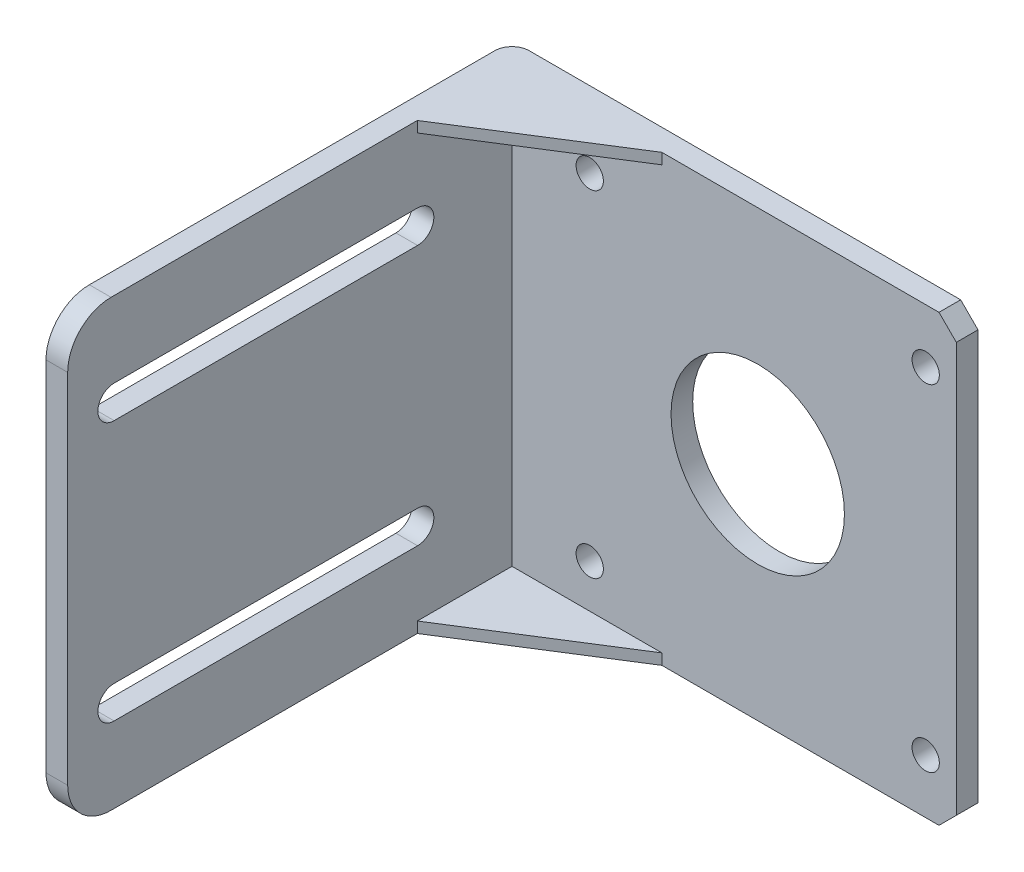
from build123d import *

# Parameters (mm, degrees)
BOSS_EXTRUDE1_DEPTH = 65.0875
SKETCH2_R           = 2
SKETCH2_R_2         = 12.7
CUT_EXTRUDE1_DEPTH  = 3.175
CUT_EXTRUDE2_DEPTH  = 3.175
BOSS_EXTRUDE2_START = -1.5875
BOSS_EXTRUDE2_DEPTH = 1.5875
CUT_EXTRUDE3_DEPTH  = 3.175


with BuildPart() as part:
    # Sketch1 → Boss-Extrude1 (new body)
    with BuildSketch(Plane(origin=(0, 0, 0), x_dir=(1, 0, 0), z_dir=(0, 1, 0))):
        with BuildLine():
            Line((32.013617701, 34.255816606), (32.013617701, 31.080816606))
            Line((32.013617701, 31.080816606), (-33.073882299, 31.080816606))
            Line((-33.073882299, 31.080816606), (-33.073882299, -34.006683394))
            Line((-33.073882299, -34.006683394), (-36.248882299, -34.006683394))
            Line((-36.248882299, -34.006683394), (-36.248882299, 31.715816606))
            ThreePointArc((-36.248882299, 31.715816606), (-35.504933523, 33.51186783), (-33.708882299, 34.255816606))
            Line((-33.708882299, 34.255816606), (32.013617701, 34.255816606))
        make_face()
    extrude(amount=BOSS_EXTRUDE1_DEPTH)

    # Sketch2 → Cut-Extrude1 (cut)
    with BuildSketch(Plane(origin=(0, 0, -34.255816606), x_dir=(-1, 0, 0), z_dir=(0, 0, -1))):
        with Locations((-27.52729049, 57.15)):
            Circle(SKETCH2_R)
        with Locations((21.68520951, 57.15)):
            Circle(SKETCH2_R)
        with Locations((21.68520951, 7.9375)):
            Circle(SKETCH2_R)
        with Locations((-27.52729049, 7.9375)):
            Circle(SKETCH2_R)
        with Locations((-2.92104049, 32.54375)):
            Circle(SKETCH2_R_2)
        Polygon((-29.473617701, 65.0875), (-32.013617701, 62.5475), (-32.013617701, 65.0875), align=None)
        Polygon((-29.473617701, 0), (-32.013617701, 2.54), (-32.013617701, 0), align=None)
    extrude(amount=-CUT_EXTRUDE1_DEPTH, mode=Mode.SUBTRACT)

    # Sketch3 → Cut-Extrude2 (cut)
    with BuildSketch(Plane.ZY.offset(36.248882299)):
        with BuildLine():
            Line((27.656683394, 65.0875), (34.006683394, 65.0875))
            Line((34.006683394, 65.0875), (34.006683394, 58.7375))
            ThreePointArc((34.006683394, 58.7375), (32.146811455, 63.227628061), (27.656683394, 65.0875))
        make_face()
        with BuildLine():
            Line((34.006683394, 6.35), (34.006683394, 0))
            Line((34.006683394, 0), (27.656683394, 0))
            ThreePointArc((27.656683394, 0), (32.146811455, 1.859871939), (34.006683394, 6.35))
        make_face()
    extrude(amount=-CUT_EXTRUDE2_DEPTH, mode=Mode.SUBTRACT)

    # Sketch4 → Boss-Extrude2 (add)
    with BuildSketch(Plane(origin=(0, 65.0875, 0), x_dir=(1, 0, 0), z_dir=(0, 1, 0)).offset(BOSS_EXTRUDE2_START)):
        with BuildLine():
            Line((-36.248882299, 31.715816606), (-36.248882299, 15.205816606))
            Line((-36.248882299, 15.205816606), (-6.086382299, 34.255816606))
            Line((-6.086382299, 34.255816606), (-33.708882299, 34.255816606))
            ThreePointArc((-33.708882299, 34.255816606), (-35.504933523, 33.51186783), (-36.248882299, 31.715816606))
        make_face()
    boss_extrude2 = extrude(amount=BOSS_EXTRUDE2_DEPTH)

    # Mirror1: Boss-Extrude2 across plane
    add(boss_extrude2.mirror(Plane(origin=(0, 32.54375, 0), x_dir=(0, 0, 1), z_dir=(0, -1, 0))))

    # Sketch5 → Cut-Extrude3 (cut)
    with BuildSketch(Plane.ZY.offset(36.248882299)):
        with BuildLine():
            Line((-17.250449478, 53.975), (27.199550522, 53.975))
            ThreePointArc((27.199550522, 53.975), (29.580800522, 51.59375), (27.199550522, 49.2125))
            Line((27.199550522, 49.2125), (-17.250449478, 49.2125))
            ThreePointArc((-17.250449478, 49.2125), (-19.631699478, 51.59375), (-17.250449478, 53.975))
        make_face()
        with BuildLine():
            Line((-17.250449478, 11.1125), (27.199550522, 11.1125))
            ThreePointArc((27.199550522, 11.1125), (29.580800522, 13.49375), (27.199550522, 15.875))
            Line((27.199550522, 15.875), (-17.250449478, 15.875))
            ThreePointArc((-17.250449478, 15.875), (-19.631699478, 13.49375), (-17.250449478, 11.1125))
        make_face()
    extrude(amount=-CUT_EXTRUDE3_DEPTH, mode=Mode.SUBTRACT)


solid = part.part
